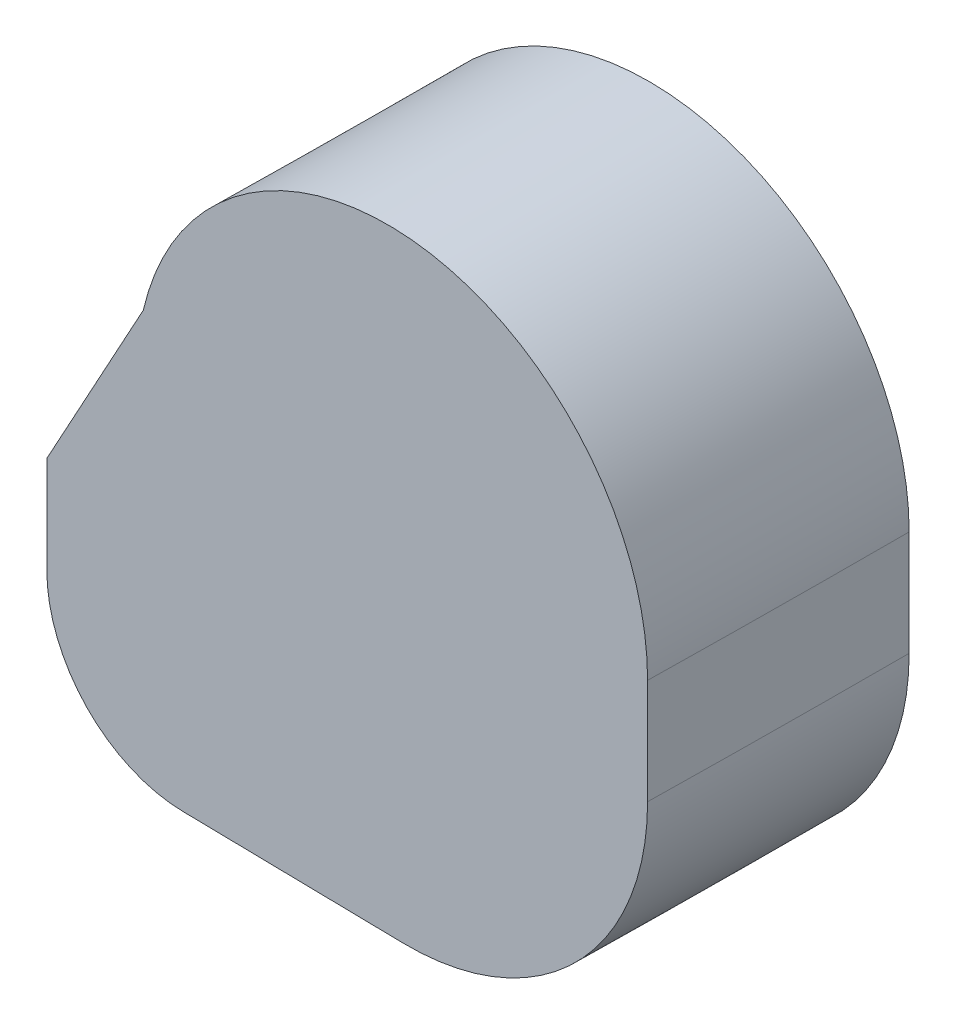
from build123d import *

# Parameters (mm, degrees)
REVOLVE1_ANGLE = 1


with BuildPart() as part:
    # Sketch4 → Revolve1 (revolve)
    with BuildSketch(Plane.XY):
        with BuildLine():
            Line((0, 0), (2.0574, 0))
            ThreePointArc((2.0574, 0), (3.673846102, 0.669553898), (4.3434, 2.286))
            Line((4.3434, 2.286), (4.3434, 3.2512))
            ThreePointArc((4.3434, 3.2512), (2.230011235, 5.623001416), (-0.368814742, 3.795993597))
            Line((-0.368814742, 3.795993597), (-1.27, 2.160242822))
            Line((-1.27, 2.160242822), (-1.27, 1.27))
            ThreePointArc((-1.27, 1.27), (-0.898025612, 0.371974388), (0, 0))
        make_face()
    revolve(axis=Axis((-132.03841004, 8.384500911, 0), (0, -1, 0)), revolution_arc=REVOLVE1_ANGLE)


solid = part.part
